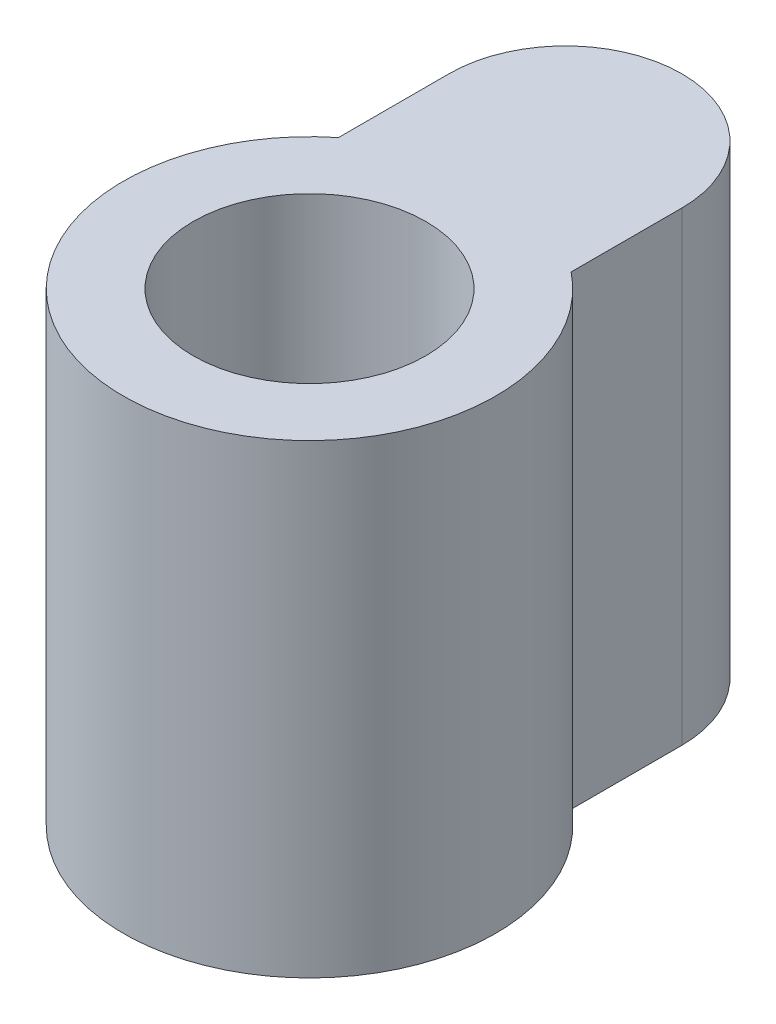
from build123d import *

# Parameters (mm, degrees)
CROQUIS1_R              = 2.5
SALIENTE_EXTRUIR1_DEPTH = 10
REDONDEO1_RADIUS        = 2.5
REDONDEO1_LENGTH        = 10


with BuildPart() as part:
    # Croquis1 → Saliente-Extruir1 (new body)
    with BuildSketch(Plane(origin=(0, 0, 0), x_dir=(1, 0, 0), z_dir=(0, 1, 0))):
        with BuildLine():
            Line((-2.5, 8), (2.5, 8))
            Line((2.5, 8), (2.5, 3.122498999))
            ThreePointArc((2.5, 3.122498999), (0, -4), (-2.5, 3.122498999))
            Line((-2.5, 3.122498999), (-2.5, 8))
        make_face()
        with Locations(Location((0, 0, 0), (0, 0, 270))):
            Circle(CROQUIS1_R, mode=Mode.SUBTRACT)
    extrude(amount=SALIENTE_EXTRUIR1_DEPTH)

    # Redondeo1: full round fillet: the end face becomes a half cylinder, R = half its width
    redondeo1_face = Plane((0, 5, -8), x_dir=(0, 1, 0), z_dir=(0, 0, -1))  # on the end face: x along it, z out of the body
    redondeo1_slab = redondeo1_face.offset(-REDONDEO1_RADIUS / 2) * Box(REDONDEO1_LENGTH, 2 * REDONDEO1_RADIUS, REDONDEO1_RADIUS, mode=Mode.PRIVATE)  # the body's end, R deep
    redondeo1_round = Plane((0, 5, -5.5), x_dir=(0, 0, -1), z_dir=(0, 1, 0)) * Cylinder(REDONDEO1_RADIUS, REDONDEO1_LENGTH, mode=Mode.PRIVATE)  # its axis R under the face
    add(redondeo1_slab - redondeo1_round, mode=Mode.SUBTRACT)


solid = part.part
